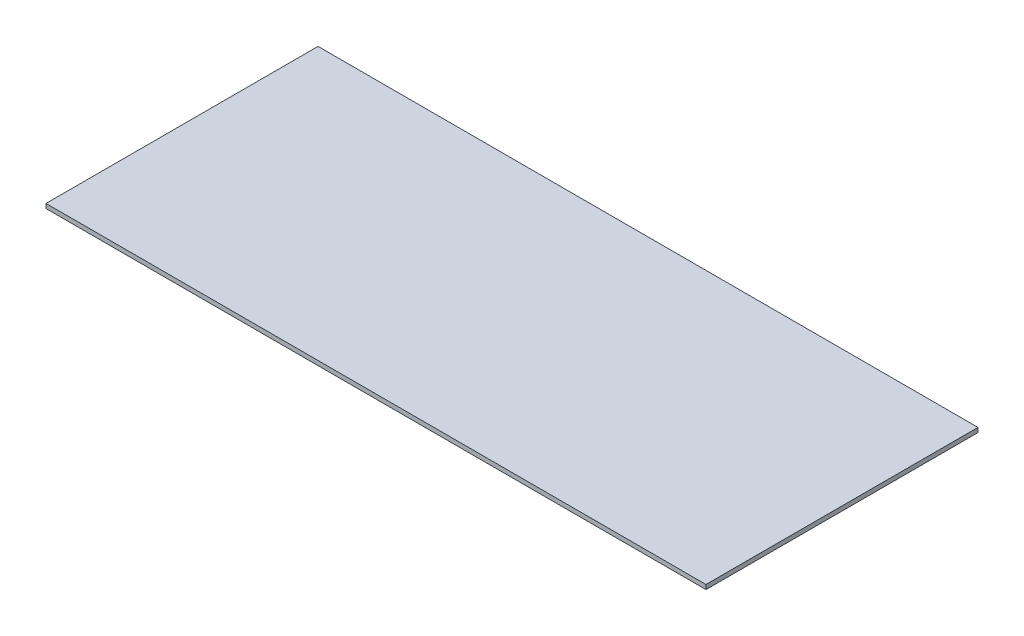
from build123d import *

# Parameters (mm, degrees)
SKETCH_1_W      = 1480
SKETCH_1_H      = 610
EXTRUDE_1_DEPTH = 10


with BuildPart() as part:
    # Эскиз1 → Бобышка-Вытянуть1 (new body)
    with BuildSketch(Plane(origin=(0, 0, 0), x_dir=(1, 0, 0), z_dir=(0, 1, 0))):
        with Locations((740, 305)):
            Rectangle(SKETCH_1_W, SKETCH_1_H)
    extrude(amount=EXTRUDE_1_DEPTH)


solid = part.part
